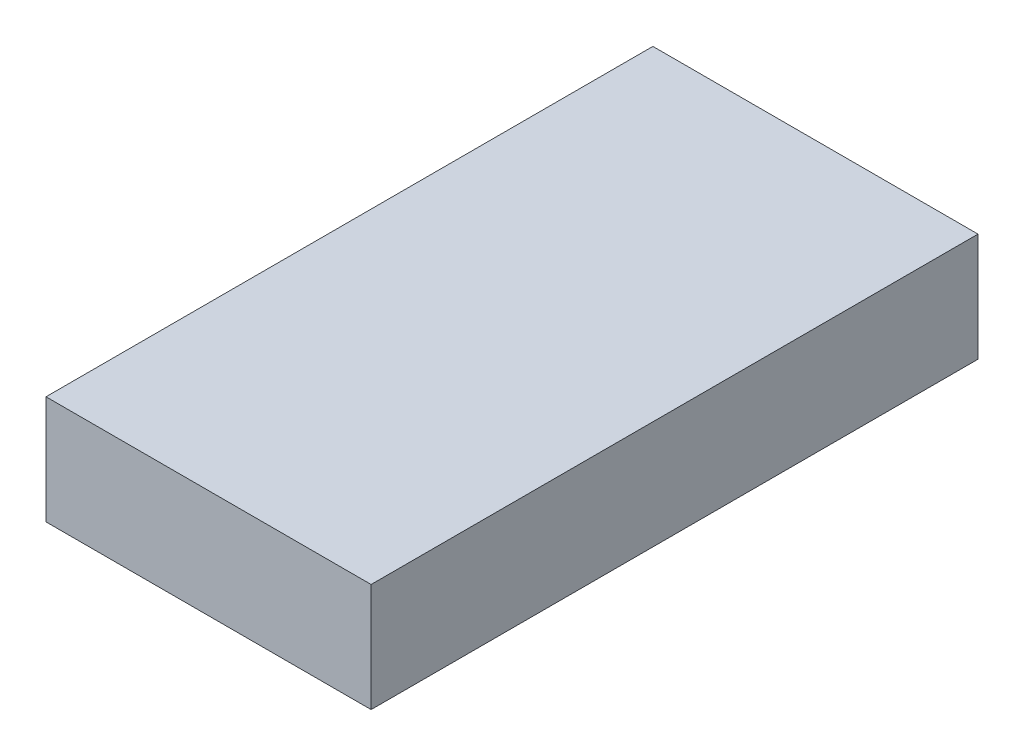
from build123d import *

# Parameters (mm, degrees)
EXTRUDE_1_DEPTH = 50
SKETCH_20_W     = 30
SKETCH_20_H     = 10
EXTRUDE_2_DEPTH = 3
SKETCH_21_W     = 30
SKETCH_21_H     = 10
EXTRUDE_3_DEPTH = 3


with BuildPart() as part:
    # 草图1 → 凸台-拉伸1 (new body)
    with BuildSketch(Plane.XY):
        Polygon((-1.5, -3), (-13, -3), (-13, 3), (-1.5, 3), (-1.5, 5), (-15, 5), (-15, -5), (-1.5, -5), align=None)
        Polygon((-1.5, 3), (-1.5, -3), (-1.5, -5), (1.5, -5), (1.5, -3), (1.5, 3), (1.5, 5), (-1.5, 5), align=None)
        Polygon((1.5, -3), (1.5, -5), (15, -5), (15, 5), (1.5, 5), (1.5, 3), (13, 3), (13, -3), align=None)
    extrude(amount=EXTRUDE_1_DEPTH)

    # 草图20 → 凸台-拉伸2 (add)
    with BuildSketch(Plane(origin=(0, 0, 0), x_dir=(-1, 0, 0), z_dir=(0, 0, -1))):
        Rectangle(SKETCH_20_W, SKETCH_20_H)
    extrude(amount=EXTRUDE_2_DEPTH)

    # 草图21 → 凸台-拉伸3 (add)
    with BuildSketch(Plane.XY.offset(50)):
        Rectangle(SKETCH_21_W, SKETCH_21_H)
    extrude(amount=EXTRUDE_3_DEPTH)


solid = part.part
